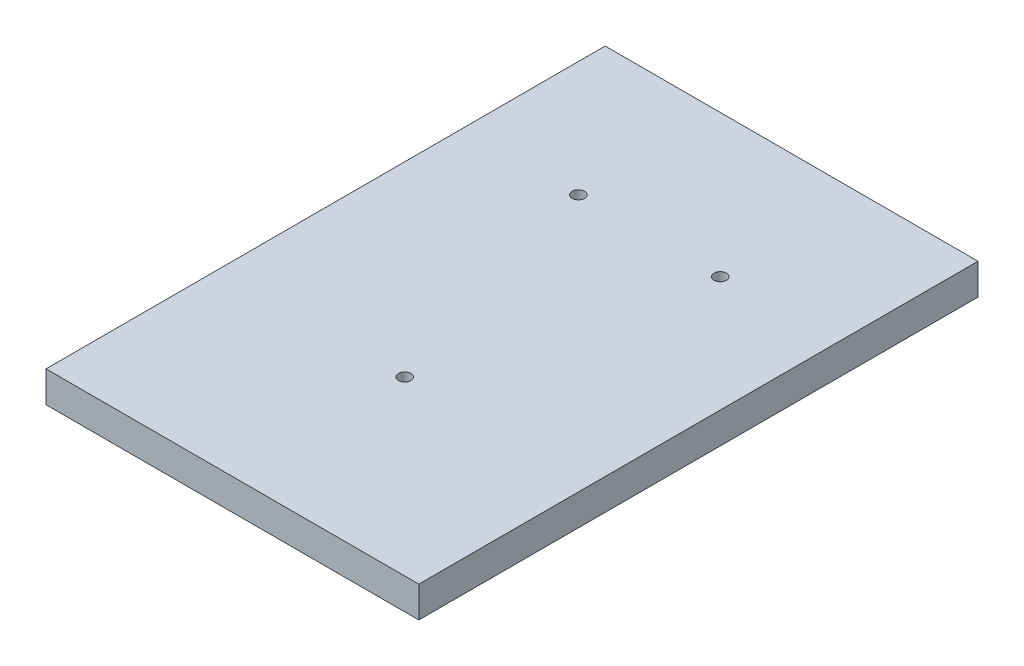
from build123d import *

# Parameters (mm, degrees)
SKETCH1_W           = 76.2
SKETCH1_H           = 114.3
SKETCH1_R           = 1.27
BOSS_EXTRUDE1_DEPTH = 6.35


with BuildPart() as part:
    # Sketch1 → Boss-Extrude1 (new body)
    with BuildSketch(Plane(origin=(0, 0, 0), x_dir=(1, 0, 0), z_dir=(0, 1, 0))):
        Rectangle(SKETCH1_W, SKETCH1_H)
        with Locations(Location((-14.5, 28.070324536, 0), (0, 0, 270))):
            Circle(SKETCH1_R, mode=Mode.SUBTRACT)
        with Locations(Location((14.5, 28.070324536, 0), (0, 0, 270))):
            Circle(SKETCH1_R, mode=Mode.SUBTRACT)
        with Locations(Location((0, -21.929675464, 0), (0, 0, 270))):
            Circle(SKETCH1_R, mode=Mode.SUBTRACT)
    extrude(amount=BOSS_EXTRUDE1_DEPTH)


solid = part.part
